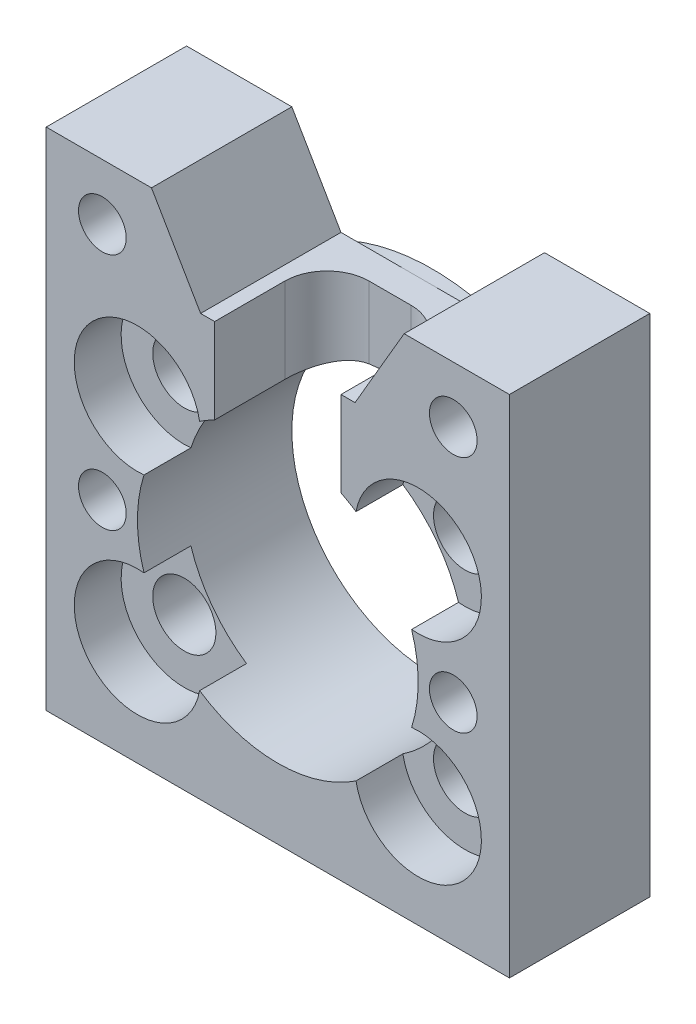
from build123d import *

# Parameters (mm, degrees)
SKETCH1_R                               = 20
BOSS_EXTRUDE1_DEPTH                     = 20
BOSS_EXTRUDE2_START                     = -2
SKETCH1_3_R                             = 20
BOSS_EXTRUDE2_DEPTH                     = 2
CBORE_FOR_M8_HEX_HEAD_BOLT1_D           = 9
CBORE_FOR_M8_HEX_HEAD_BOLT1_CBORE_D     = 18.01
CBORE_FOR_M8_HEX_HEAD_BOLT1_CBORE_DEPTH = 6.68
M8X1_25_TAPPED_HOLE1_D                  = 6.8
M8X1_25_TAPPED_HOLE1_DEPTH              = 20
M8X1_25_TAPPED_HOLE1_TIP                = 2.042926105
CUT_EXTRUDE1_DEPTH                      = 58.035076926


with BuildPart() as part:
    # Sketch1 → Boss-Extrude1 (new body)
    with BuildSketch(Plane.XY):
        Polygon((-18, 42), (-33, 42), (-33, -30), (33, -30), (33, 42), (18, 42), (11, 30), (-11, 30), align=None)
        Circle(SKETCH1_R, mode=Mode.SUBTRACT)
    extrude(amount=BOSS_EXTRUDE1_DEPTH)

    # Sketch1<3> → Boss-Extrude2 (add)
    with BuildSketch(Plane.XY.offset(BOSS_EXTRUDE2_START)):
        with BuildLine():
            ThreePointArc((-1.8e-08, 30), (-30, -3.2e-08), (4.6e-08, -30))
            ThreePointArc((4.6e-08, -30), (21.213203452, -21.213203419), (30, 0))
            ThreePointArc((30, 0), (21.213203429, 21.213203442), (-1.8e-08, 30))
        make_face()
        Circle(SKETCH1_3_R, mode=Mode.SUBTRACT)
    extrude(amount=BOSS_EXTRUDE2_DEPTH)

    # CBORE for M8 Hex Head Bolt1 (through all)
    with Locations(Plane.XY.offset(20)):
        with Locations((-20, 15), (20, 15), (-20, -15), (20, -15)):
            CounterBoreHole(CBORE_FOR_M8_HEX_HEAD_BOLT1_D / 2, CBORE_FOR_M8_HEX_HEAD_BOLT1_CBORE_D / 2, CBORE_FOR_M8_HEX_HEAD_BOLT1_CBORE_DEPTH)

    # M8x1.25 Tapped Hole1
    with Locations(Plane.XY.offset(20)):
        with Locations((-25, 34), (25, 34), (25, 0), (-25, 0)):
            Hole(M8X1_25_TAPPED_HOLE1_D / 2, depth=M8X1_25_TAPPED_HOLE1_DEPTH)
            with Locations((0, 0, -(M8X1_25_TAPPED_HOLE1_DEPTH + M8X1_25_TAPPED_HOLE1_TIP / 2))):  # 118° drill point
                Cone(0, M8X1_25_TAPPED_HOLE1_D / 2, M8X1_25_TAPPED_HOLE1_TIP, mode=Mode.SUBTRACT)

    # Sketch7 → Cut-Extrude1 (cut, through all)
    with BuildSketch(Plane(origin=(0, 0, 0), x_dir=(1, 0, 0), z_dir=(0, 1, 0))):
        with BuildLine():
            Line((-9, -20), (9, -20))
            Line((9, -20), (9, -10))
            ThreePointArc((9, -10), (7.242640687, -5.757359313), (3, -4))
            Line((3, -4), (-3, -4))
            ThreePointArc((-3, -4), (-7.242640687, -5.757359313), (-9, -10))
            Line((-9, -10), (-9, -20))
        make_face()
    extrude(amount=CUT_EXTRUDE1_DEPTH, mode=Mode.SUBTRACT)


solid = part.part
